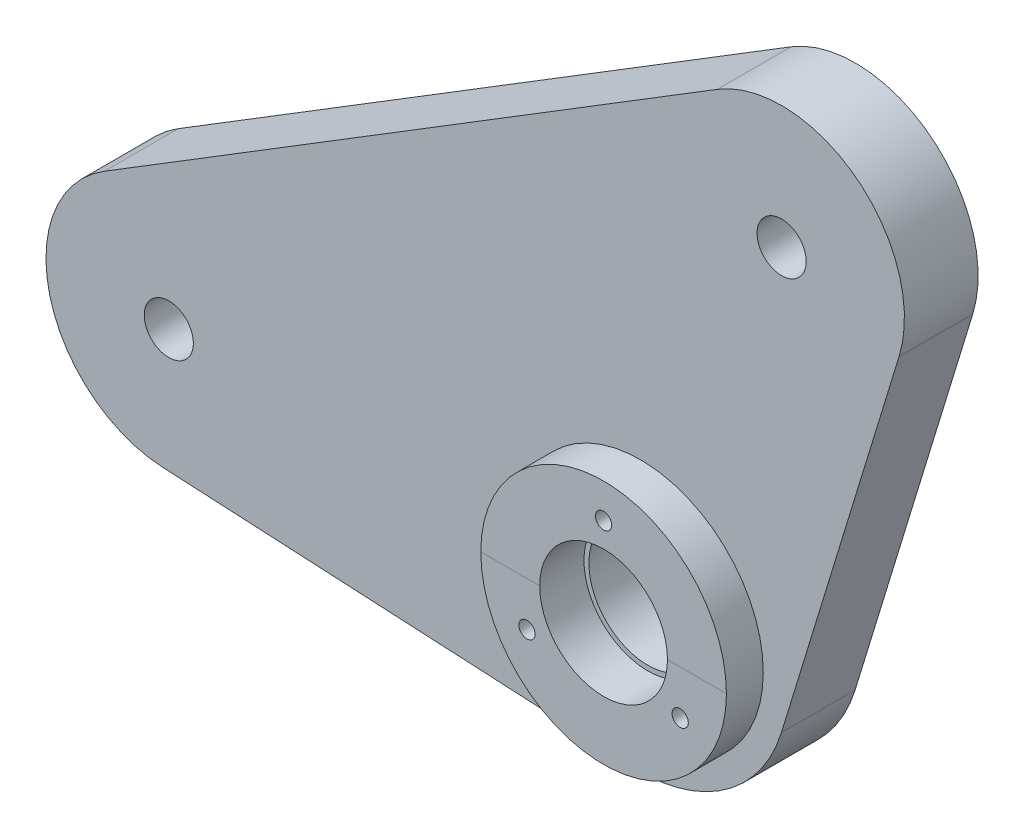
from build123d import *

# Parameters (mm, degrees)
BASELINE_BODY_DEPTH   = 7.5
SKETCH3_R             = 5
CUT_EXTRUDE1_DEPTH    = 159.837149307
SKETCH4_R             = 25
BOSS_EXTRUDE2_DEPTH   = 15
SKETCH5_R             = 12
CUT_EXTRUDE2_DEPTH    = 161.947941894
SKETCH6_R             = 13
CUT_EXTRUDE3_DEPTH    = 9
CUT_EXTRUDE4_START    = -9
SKETCH7_R             = 13
CUT_EXTRUDE4_DEPTH    = 9
M4_TAPPED_HOLE6_D     = 3.3
M4_TAPPED_HOLE6_DEPTH = 9
M4_TAPPED_HOLE6_TIP   = 0.991420021
M4_TAPPED_HOLE8_D     = 3.3
M4_TAPPED_HOLE8_DEPTH = 9
M4_TAPPED_HOLE8_TIP   = 0.991420021


with BuildPart() as part:
    # Rocker_Profile → Baseline_Body (new, symmetric)
    with BuildSketch(Plane.XY):
        with BuildLine():
            Line((-97.302083333, -24.966068553), (-1.5625, -29.959282264))
            ThreePointArc((-1.5625, -29.959282264), (17.206458335, -24.57514581), (28.686326507, -8.780357142))
            Line((28.686326507, -8.780357142), (52.641312178, 69.483035715))
            ThreePointArc((52.641312178, 69.483035715), (44.023831603, 96.580885487), (15.628732451, 98.088458997))
            Line((15.628732451, 98.088458997), (-109.107307638, 21.288458997))
            ThreePointArc((-109.107307638, 21.288458997), (-120.2235003, -6.182397046), (-97.302083333, -24.966068553))
        make_face()
    extrude(amount=BASELINE_BODY_DEPTH, both=True)

    # Sketch3 → Cut-Extrude1 (cut, through all)
    with BuildSketch(Plane.XY.offset(7.5)):
        with Locations((-96, 0)):
            Circle(SKETCH3_R)
        with Locations((28.736040089, 76.8)):
            Circle(SKETCH3_R)
    extrude(amount=-CUT_EXTRUDE1_DEPTH, mode=Mode.SUBTRACT)

    # Sketch4 → Boss-Extrude2 (add, symmetric)
    with BuildSketch(Plane.XY):
        Circle(SKETCH4_R)
    extrude(amount=BOSS_EXTRUDE2_DEPTH, both=True)

    # Sketch5 → Cut-Extrude2 (cut, through all)
    with BuildSketch(Plane.XY.offset(15)):
        Circle(SKETCH5_R)
    extrude(amount=-CUT_EXTRUDE2_DEPTH, mode=Mode.SUBTRACT)

    # Sketch6 → Cut-Extrude3 (cut)
    with BuildSketch(Plane.XY.offset(15)):
        Circle(SKETCH6_R)
    extrude(amount=-CUT_EXTRUDE3_DEPTH, mode=Mode.SUBTRACT)

    # Sketch7 → Cut-Extrude4 (cut)
    with BuildSketch(Plane(origin=(0, 0, -15), x_dir=(-1, 0, 0), z_dir=(0, 0, -1)).offset(CUT_EXTRUDE4_START)):
        with Locations(Location((0, 0, 0), (0, 0, 180))):
            Circle(SKETCH7_R)
    extrude(amount=CUT_EXTRUDE4_DEPTH, mode=Mode.SUBTRACT)

    # M4 Tapped Hole6
    with Locations(Plane.XY.offset(15)):
        with Locations((-15.588457268, -9), (0, 18), (15.588457268, -9)):
            Hole(M4_TAPPED_HOLE6_D / 2, depth=M4_TAPPED_HOLE6_DEPTH)
            with Locations((0, 0, -(M4_TAPPED_HOLE6_DEPTH + M4_TAPPED_HOLE6_TIP / 2))):  # 118° drill point
                Cone(0, M4_TAPPED_HOLE6_D / 2, M4_TAPPED_HOLE6_TIP, mode=Mode.SUBTRACT)

    # M4 Tapped Hole8
    with Locations(Plane(origin=(0, 0, -15), x_dir=(-1, 0, 0), z_dir=(0, 0, -1))):
        with Locations((-15.588457268, -9), (0, 18), (15.585467422, -8.998273811)):
            Hole(M4_TAPPED_HOLE8_D / 2, depth=M4_TAPPED_HOLE8_DEPTH)
            with Locations((0, 0, -(M4_TAPPED_HOLE8_DEPTH + M4_TAPPED_HOLE8_TIP / 2))):  # 118° drill point
                Cone(0, M4_TAPPED_HOLE8_D / 2, M4_TAPPED_HOLE8_TIP, mode=Mode.SUBTRACT)


solid = part.part
